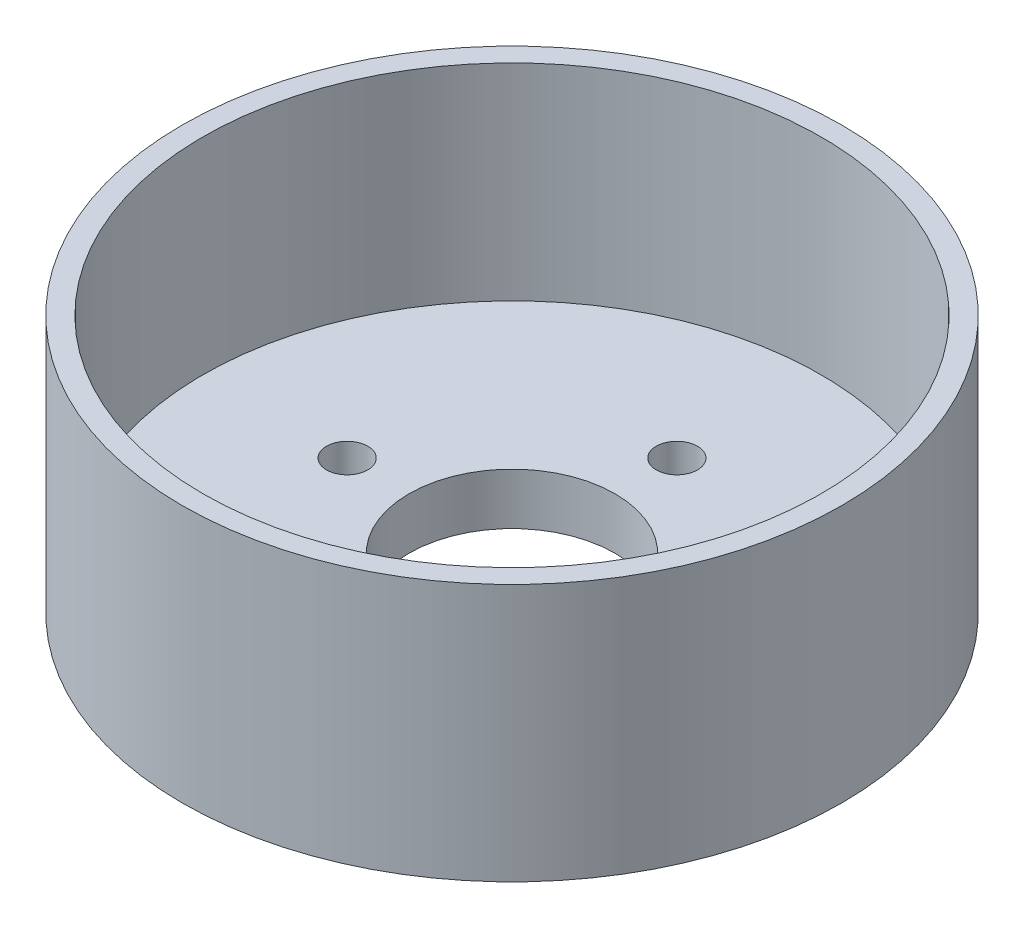
from build123d import *

# Parameters (mm, degrees)
SKETCH1_R           = 16
BOSS_EXTRUDE1_DEPTH = 12.5
SKETCH2_R           = 15
CUT_EXTRUDE1_DEPTH  = 10
SKETCH3_R           = 5
CUT_EXTRUDE2_DEPTH  = 10
SKETCH4_R           = 1
CUT_EXTRUDE3_DEPTH  = 10


with BuildPart() as part:
    # Sketch1 → Boss-Extrude1 (new body)
    with BuildSketch(Plane(origin=(0, 0, 0), x_dir=(1, 0, 0), z_dir=(0, 1, 0))):
        with Locations(Location((0, 0, 0), (0, 0, 270))):
            Circle(SKETCH1_R)
    extrude(amount=BOSS_EXTRUDE1_DEPTH)

    # Sketch2 → Cut-Extrude1 (cut)
    with BuildSketch(Plane(origin=(0, 12.5, 0), x_dir=(1, 0, 0), z_dir=(0, 1, 0))):
        with Locations(Location((0, 0, 0), (0, 0, 270))):
            Circle(SKETCH2_R)
    extrude(amount=-CUT_EXTRUDE1_DEPTH, mode=Mode.SUBTRACT)

    # Sketch3 → Cut-Extrude2 (cut)
    with BuildSketch(Plane(origin=(0, 0, 0), x_dir=(-1, 0, 0), z_dir=(0, -1, 0))):
        with Locations(Location((0, 0, 0), (0, 0, 90))):
            Circle(SKETCH3_R)
    extrude(amount=-CUT_EXTRUDE2_DEPTH, mode=Mode.SUBTRACT)

    # Sketch4 → Cut-Extrude3 (cut)
    with BuildSketch(Plane(origin=(0, 0, 0), x_dir=(-1, 0, 0), z_dir=(0, -1, 0))):
        with Locations(Location((0, 8, 0), (0, 0, 90))):
            Circle(SKETCH4_R)
        with Locations(Location((0, -8, 0), (0, 0, 90))):
            Circle(SKETCH4_R)
        with Locations(Location((-8, 0, 0), (0, 0, 90))):
            Circle(SKETCH4_R)
        with Locations(Location((8, 0, 0), (0, 0, 90))):
            Circle(SKETCH4_R)
    extrude(amount=-CUT_EXTRUDE3_DEPTH, mode=Mode.SUBTRACT)


solid = part.part
